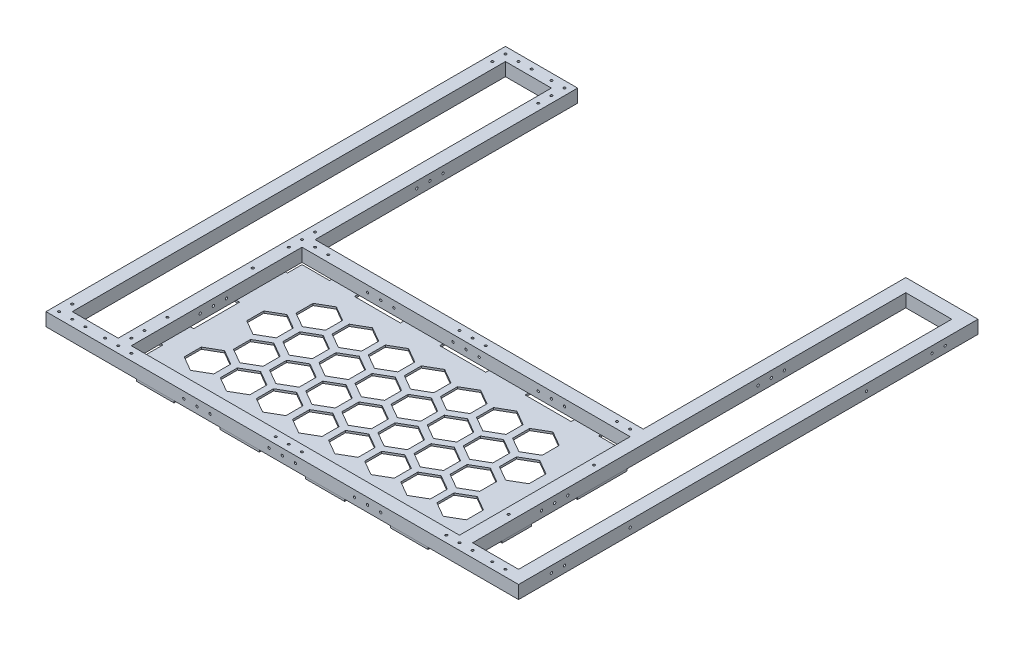
from build123d import *

# Parameters (mm, degrees)
SKETCH_1_W           = 20
SKETCH_1_H           = 660
SKETCH_1_W_2         = 500
SKETCH_1_H_2         = 20
SKETCH_1_W_3         = 720
SKETCH_1_W_4         = 110
EXTRUDE_1_DEPTH      = 20
SKETCH_3_R           = 1.75
CUT_EXTRUDE_1_DEPTH  = 20
CUT_EXTRUDE_2_REACH  = 830.794
SKETCH_4_R           = 1.75
CUT_EXTRUDE_3_REACH  = 753.931
SKETCH_5_R           = 1.75
CUT_EXTRUDE_4_REACH  = 737.255
SKETCH_6_R           = 1.75
SKETCH_7_R           = 1.75
CUT_EXTRUDE_5_DEPTH  = 20
SKETCH_8_R           = 1.75
CUT_EXTRUDE_6_DEPTH  = 20
SKETCH_9_R           = 1.75
CUT_EXTRUDE_7_DEPTH  = 20
SKETCH_10_R          = 1.75
CUT_EXTRUDE_8_DEPTH  = 20
SKETCH_11_R          = 1.75
CUT_EXTRUDE_9_DEPTH  = 20
EXTRUDE_7_DEPTH      = 3
SKETCH_17_R          = 2
CUT_EXTRUDE_10_DEPTH = 3
CUT_EXTRUDE_11_DEPTH = 3


with BuildPart() as part:
    # 草图1 → 凸台-拉伸1 (new body)
    with BuildSketch(Plane(origin=(0, 0, 0), x_dir=(1, 0, 0), z_dir=(0, 1, 0))):
        Polygon((-250, -10), (-250, 10), (-250, 390), (-270, 390), (-270, -270), (-250, -270), align=None)
        Polygon((-270, 390), (-250, 390), (-250, 410), (-360, 410), (-360, 390), (-340, 390), align=None)
        with Locations((-350, 60)):
            Rectangle(SKETCH_1_W, SKETCH_1_H)
        Rectangle(SKETCH_1_W_2, SKETCH_1_H_2)
        with Locations((0, -280)):
            Rectangle(SKETCH_1_W_3, SKETCH_1_H_2)
        Polygon((250, 390), (250, 10), (250, -10), (250, -270), (270, -270), (270, 390), align=None)
        with Locations((350, 60)):
            Rectangle(SKETCH_1_W, SKETCH_1_H)
        with Locations((305, 400)):
            Rectangle(SKETCH_1_W_4, SKETCH_1_H_2)
    extrude(amount=EXTRUDE_1_DEPTH)

    # 草图3 → 切除-拉伸1 (cut)
    with BuildSketch(Plane.XZ):
        with Locations(Location((-330, 280, 0), (0, 0, 270))):
            Circle(SKETCH_3_R)
        with Locations(Location((-310, 280, 0), (0, 0, 270))):
            Circle(SKETCH_3_R)
        with Locations(Location((-350, 260, 0), (0, 0, 270))):
            Circle(SKETCH_3_R)
        with Locations(Location((-350, -380, 0), (0, 0, 270))):
            Circle(SKETCH_3_R)
        with Locations(Location((-330, -400, 0), (0, 0, 270))):
            Circle(SKETCH_3_R)
        with Locations(Location((-310, -400, 0), (0, 0, 270))):
            Circle(SKETCH_3_R)
        with Locations(Location((-280, -400, 0), (0, 0, 270))):
            Circle(SKETCH_3_R)
        with Locations(Location((-260, -360, 0), (0, 0, 270))):
            Circle(SKETCH_3_R)
        with Locations(Location((-260, 280, 0), (0, 0, 270))):
            Circle(SKETCH_3_R)
        with Locations(Location((-240, 280, 0), (0, 0, 270))):
            Circle(SKETCH_3_R)
        with Locations(Location((-280, 280, 0), (0, 0, 270))):
            Circle(SKETCH_3_R)
        with Locations(Location((-260, 260, 0), (0, 0, 270))):
            Circle(SKETCH_3_R)
        with Locations(Location((-260, 240, 0), (0, 0, 270))):
            Circle(SKETCH_3_R)
        with Locations(Location((-260, 20, 0), (0, 0, 270))):
            Circle(SKETCH_3_R)
        with Locations(Location((-260, 0, 0), (0, 0, 270))):
            Circle(SKETCH_3_R)
        with Locations(Location((-260, -20, 0), (0, 0, 270))):
            Circle(SKETCH_3_R)
        with Locations(Location((-240, 0, 0), (0, 0, 270))):
            Circle(SKETCH_3_R)
        with Locations(Location((-220, 0, 0), (0, 0, 270))):
            Circle(SKETCH_3_R)
        with Locations(Location((240, 0, 0), (0, 0, 270))):
            Circle(SKETCH_3_R)
        with Locations(Location((220, 0, 0), (0, 0, 270))):
            Circle(SKETCH_3_R)
        with Locations(Location((240, 280, 0), (0, 0, 270))):
            Circle(SKETCH_3_R)
        with Locations(Location((280, 280, 0), (0, 0, 270))):
            Circle(SKETCH_3_R)
        with Locations(Location((330, 280, 0), (0, 0, 270))):
            Circle(SKETCH_3_R)
        with Locations(Location((310, 280, 0), (0, 0, 270))):
            Circle(SKETCH_3_R)
        with Locations(Location((-350, 280, 0), (0, 0, 270))):
            Circle(SKETCH_3_R)
        with Locations(Location((-350, -400, 0), (0, 0, 270))):
            Circle(SKETCH_3_R)
        with Locations(Location((-260, -400, 0), (0, 0, 270))):
            Circle(SKETCH_3_R)
        with Locations(Location((-260, -380, 0), (0, 0, 270))):
            Circle(SKETCH_3_R)
        with Locations(Location((260, 280, 0), (0, 0, 90))):
            Circle(SKETCH_3_R)
    extrude(amount=-CUT_EXTRUDE_1_DEPTH, mode=Mode.SUBTRACT)

    # 草图4 → 切除-拉伸2 (cut, up to next)
    with BuildSketch(Plane(origin=(360, 0, 0), x_dir=(0, 0, -1), z_dir=(1, 0, 0)), mode=Mode.PRIVATE) as cut_extrude_2_sk1:
        with Locations((-240, 10)):
            Circle(SKETCH_4_R)
    cut_extrude_2_tool1 = extrude(cut_extrude_2_sk1.sketch, amount=-CUT_EXTRUDE_2_REACH, mode=Mode.PRIVATE) & part.part
    # 草图4 → 切除-拉伸2 (cut, up to next)
    with BuildSketch(Plane(origin=(360, 0, 0), x_dir=(0, 0, -1), z_dir=(1, 0, 0)), mode=Mode.PRIVATE) as cut_extrude_2_sk2:
        with Locations((-220, 10)):
            Circle(SKETCH_4_R)
    cut_extrude_2_tool2 = extrude(cut_extrude_2_sk2.sketch, amount=-CUT_EXTRUDE_2_REACH, mode=Mode.PRIVATE) & part.part
    # 草图4 → 切除-拉伸2 (cut, up to next)
    with BuildSketch(Plane(origin=(360, 0, 0), x_dir=(0, 0, -1), z_dir=(1, 0, 0)), mode=Mode.PRIVATE) as cut_extrude_2_sk3:
        with Locations((-120, 10)):
            Circle(SKETCH_4_R)
    cut_extrude_2_tool3 = extrude(cut_extrude_2_sk3.sketch, amount=-CUT_EXTRUDE_2_REACH, mode=Mode.PRIVATE) & part.part
    # 草图4 → 切除-拉伸2 (cut, up to next)
    with BuildSketch(Plane(origin=(360, 0, 0), x_dir=(0, 0, -1), z_dir=(1, 0, 0)), mode=Mode.PRIVATE) as cut_extrude_2_sk4:
        with Locations((360, 10)):
            Circle(SKETCH_4_R)
    cut_extrude_2_tool4 = extrude(cut_extrude_2_sk4.sketch, amount=-CUT_EXTRUDE_2_REACH, mode=Mode.PRIVATE) & part.part
    # 草图4 → 切除-拉伸2 (cut, up to next)
    with BuildSketch(Plane(origin=(360, 0, 0), x_dir=(0, 0, -1), z_dir=(1, 0, 0)), mode=Mode.PRIVATE) as cut_extrude_2_sk5:
        with Locations((340, 10)):
            Circle(SKETCH_4_R)
    cut_extrude_2_tool5 = extrude(cut_extrude_2_sk5.sketch, amount=-CUT_EXTRUDE_2_REACH, mode=Mode.PRIVATE) & part.part
    # 草图4 → 切除-拉伸2 (cut, up to next)
    with BuildSketch(Plane(origin=(360, 0, 0), x_dir=(0, 0, -1), z_dir=(1, 0, 0)), mode=Mode.PRIVATE) as cut_extrude_2_sk6:
        with Locations((240, 10)):
            Circle(SKETCH_4_R)
    cut_extrude_2_tool6 = extrude(cut_extrude_2_sk6.sketch, amount=-CUT_EXTRUDE_2_REACH, mode=Mode.PRIVATE) & part.part
    add(cut_extrude_2_tool1.solids().sort_by_distance((360, 10, 240))[0], mode=Mode.SUBTRACT)
    add(cut_extrude_2_tool2.solids().sort_by_distance((360, 10, 220))[0], mode=Mode.SUBTRACT)
    add(cut_extrude_2_tool3.solids().sort_by_distance((360, 10, 120))[0], mode=Mode.SUBTRACT)
    add(cut_extrude_2_tool4.solids().sort_by_distance((360, 10, -360))[0], mode=Mode.SUBTRACT)
    add(cut_extrude_2_tool5.solids().sort_by_distance((360, 10, -340))[0], mode=Mode.SUBTRACT)
    add(cut_extrude_2_tool6.solids().sort_by_distance((360, 10, -240))[0], mode=Mode.SUBTRACT)

    # 草图5 → 切除-拉伸3 (cut, up to next)
    with BuildSketch(Plane(origin=(270, 0, 0), x_dir=(0, 0, -1), z_dir=(1, 0, 0)), mode=Mode.PRIVATE) as cut_extrude_3_sk1:
        with Locations((165, 10)):
            Circle(SKETCH_5_R)
    cut_extrude_3_tool1 = extrude(cut_extrude_3_sk1.sketch, amount=-CUT_EXTRUDE_3_REACH, mode=Mode.PRIVATE) & part.part
    # 草图5 → 切除-拉伸3 (cut, up to next)
    with BuildSketch(Plane(origin=(270, 0, 0), x_dir=(0, 0, -1), z_dir=(1, 0, 0)), mode=Mode.PRIVATE) as cut_extrude_3_sk2:
        with Locations((185, 10)):
            Circle(SKETCH_5_R)
    cut_extrude_3_tool2 = extrude(cut_extrude_3_sk2.sketch, amount=-CUT_EXTRUDE_3_REACH, mode=Mode.PRIVATE) & part.part
    # 草图5 → 切除-拉伸3 (cut, up to next)
    with BuildSketch(Plane(origin=(270, 0, 0), x_dir=(0, 0, -1), z_dir=(1, 0, 0)), mode=Mode.PRIVATE) as cut_extrude_3_sk3:
        with Locations((205, 10)):
            Circle(SKETCH_5_R)
    cut_extrude_3_tool3 = extrude(cut_extrude_3_sk3.sketch, amount=-CUT_EXTRUDE_3_REACH, mode=Mode.PRIVATE) & part.part
    # 草图5 → 切除-拉伸3 (cut, up to next)
    with BuildSketch(Plane(origin=(270, 0, 0), x_dir=(0, 0, -1), z_dir=(1, 0, 0)), mode=Mode.PRIVATE) as cut_extrude_3_sk4:
        with Locations((-125, 10)):
            Circle(SKETCH_5_R)
    cut_extrude_3_tool4 = extrude(cut_extrude_3_sk4.sketch, amount=-CUT_EXTRUDE_3_REACH, mode=Mode.PRIVATE) & part.part
    # 草图5 → 切除-拉伸3 (cut, up to next)
    with BuildSketch(Plane(origin=(270, 0, 0), x_dir=(0, 0, -1), z_dir=(1, 0, 0)), mode=Mode.PRIVATE) as cut_extrude_3_sk5:
        with Locations((-145, 10)):
            Circle(SKETCH_5_R)
    cut_extrude_3_tool5 = extrude(cut_extrude_3_sk5.sketch, amount=-CUT_EXTRUDE_3_REACH, mode=Mode.PRIVATE) & part.part
    # 草图5 → 切除-拉伸3 (cut, up to next)
    with BuildSketch(Plane(origin=(270, 0, 0), x_dir=(0, 0, -1), z_dir=(1, 0, 0)), mode=Mode.PRIVATE) as cut_extrude_3_sk6:
        with Locations((-165, 10)):
            Circle(SKETCH_5_R)
    cut_extrude_3_tool6 = extrude(cut_extrude_3_sk6.sketch, amount=-CUT_EXTRUDE_3_REACH, mode=Mode.PRIVATE) & part.part
    add(cut_extrude_3_tool1.solids().sort_by_distance((270, 10, -165))[0], mode=Mode.SUBTRACT)
    add(cut_extrude_3_tool2.solids().sort_by_distance((270, 10, -185))[0], mode=Mode.SUBTRACT)
    add(cut_extrude_3_tool3.solids().sort_by_distance((270, 10, -205))[0], mode=Mode.SUBTRACT)
    add(cut_extrude_3_tool4.solids().sort_by_distance((270, 10, 125))[0], mode=Mode.SUBTRACT)
    add(cut_extrude_3_tool5.solids().sort_by_distance((270, 10, 145))[0], mode=Mode.SUBTRACT)
    add(cut_extrude_3_tool6.solids().sort_by_distance((270, 10, 165))[0], mode=Mode.SUBTRACT)

    # 草图6 → 切除-拉伸4 (cut, up to next)
    with BuildSketch(Plane(origin=(-250, 0, 0), x_dir=(0, 0, -1), z_dir=(1, 0, 0)), mode=Mode.PRIVATE) as cut_extrude_4_sk1:
        with Locations((205, 10)):
            Circle(SKETCH_6_R)
    cut_extrude_4_tool1 = extrude(cut_extrude_4_sk1.sketch, amount=-CUT_EXTRUDE_4_REACH, mode=Mode.PRIVATE) & part.part
    # 草图6 → 切除-拉伸4 (cut, up to next)
    with BuildSketch(Plane(origin=(-250, 0, 0), x_dir=(0, 0, -1), z_dir=(1, 0, 0)), mode=Mode.PRIVATE) as cut_extrude_4_sk2:
        with Locations((185, 10)):
            Circle(SKETCH_6_R)
    cut_extrude_4_tool2 = extrude(cut_extrude_4_sk2.sketch, amount=-CUT_EXTRUDE_4_REACH, mode=Mode.PRIVATE) & part.part
    # 草图6 → 切除-拉伸4 (cut, up to next)
    with BuildSketch(Plane(origin=(-250, 0, 0), x_dir=(0, 0, -1), z_dir=(1, 0, 0)), mode=Mode.PRIVATE) as cut_extrude_4_sk3:
        with Locations((165, 10)):
            Circle(SKETCH_6_R)
    cut_extrude_4_tool3 = extrude(cut_extrude_4_sk3.sketch, amount=-CUT_EXTRUDE_4_REACH, mode=Mode.PRIVATE) & part.part
    # 草图6 → 切除-拉伸4 (cut, up to next)
    with BuildSketch(Plane(origin=(-250, 0, 0), x_dir=(0, 0, -1), z_dir=(1, 0, 0)), mode=Mode.PRIVATE) as cut_extrude_4_sk4:
        with Locations((-165, 10)):
            Circle(SKETCH_6_R)
    cut_extrude_4_tool4 = extrude(cut_extrude_4_sk4.sketch, amount=-CUT_EXTRUDE_4_REACH, mode=Mode.PRIVATE) & part.part
    # 草图6 → 切除-拉伸4 (cut, up to next)
    with BuildSketch(Plane(origin=(-250, 0, 0), x_dir=(0, 0, -1), z_dir=(1, 0, 0)), mode=Mode.PRIVATE) as cut_extrude_4_sk5:
        with Locations((-145, 10)):
            Circle(SKETCH_6_R)
    cut_extrude_4_tool5 = extrude(cut_extrude_4_sk5.sketch, amount=-CUT_EXTRUDE_4_REACH, mode=Mode.PRIVATE) & part.part
    # 草图6 → 切除-拉伸4 (cut, up to next)
    with BuildSketch(Plane(origin=(-250, 0, 0), x_dir=(0, 0, -1), z_dir=(1, 0, 0)), mode=Mode.PRIVATE) as cut_extrude_4_sk6:
        with Locations((-125, 10)):
            Circle(SKETCH_6_R)
    cut_extrude_4_tool6 = extrude(cut_extrude_4_sk6.sketch, amount=-CUT_EXTRUDE_4_REACH, mode=Mode.PRIVATE) & part.part
    add(cut_extrude_4_tool1.solids().sort_by_distance((-250, 10, -205))[0], mode=Mode.SUBTRACT)
    add(cut_extrude_4_tool2.solids().sort_by_distance((-250, 10, -185))[0], mode=Mode.SUBTRACT)
    add(cut_extrude_4_tool3.solids().sort_by_distance((-250, 10, -165))[0], mode=Mode.SUBTRACT)
    add(cut_extrude_4_tool4.solids().sort_by_distance((-250, 10, 165))[0], mode=Mode.SUBTRACT)
    add(cut_extrude_4_tool5.solids().sort_by_distance((-250, 10, 145))[0], mode=Mode.SUBTRACT)
    add(cut_extrude_4_tool6.solids().sort_by_distance((-250, 10, 125))[0], mode=Mode.SUBTRACT)

    # 草图7 → 切除-拉伸5 (cut)
    with BuildSketch(Plane.XY.offset(10)):
        with Locations((0, 10)):
            Circle(SKETCH_7_R)
        with Locations((20, 10)):
            Circle(SKETCH_7_R)
        with Locations((-20, 10)):
            Circle(SKETCH_7_R)
        with Locations((110, 10)):
            Circle(SKETCH_7_R)
        with Locations((130, 10)):
            Circle(SKETCH_7_R)
        with Locations((150, 10)):
            Circle(SKETCH_7_R)
        with Locations((-110, 10)):
            Circle(SKETCH_7_R)
        with Locations((-130, 10)):
            Circle(SKETCH_7_R)
        with Locations((-150, 10)):
            Circle(SKETCH_7_R)
    extrude(amount=-CUT_EXTRUDE_5_DEPTH, mode=Mode.SUBTRACT)

    # 草图8 → 切除-拉伸6 (cut)
    with BuildSketch(Plane.XY.offset(290)):
        with Locations((-130, 10)):
            Circle(SKETCH_8_R)
        with Locations((-110, 10)):
            Circle(SKETCH_8_R)
        with Locations((150, 10)):
            Circle(SKETCH_8_R)
        with Locations((130, 10)):
            Circle(SKETCH_8_R)
        with Locations((110, 10)):
            Circle(SKETCH_8_R)
        with Locations((-20, 10)):
            Circle(SKETCH_8_R)
        with Locations((20, 10)):
            Circle(SKETCH_8_R)
        with Locations((0, 10)):
            Circle(SKETCH_8_R)
        with Locations((-150, 10)):
            Circle(SKETCH_8_R)
    extrude(amount=-CUT_EXTRUDE_6_DEPTH, mode=Mode.SUBTRACT)

    # 草图9 → 切除-拉伸7 (cut)
    with BuildSketch(Plane(origin=(0, 20, 0), x_dir=(1, 0, 0), z_dir=(0, 1, 0))):
        with Locations(Location((0, 0, 0), (0, 0, 270))):
            Circle(SKETCH_9_R)
        with Locations(Location((20, 0, 0), (0, 0, 270))):
            Circle(SKETCH_9_R)
        with Locations(Location((-20, 0, 0), (0, 0, 270))):
            Circle(SKETCH_9_R)
    extrude(amount=-CUT_EXTRUDE_7_DEPTH, mode=Mode.SUBTRACT)

    # 草图10 → 切除-拉伸8 (cut)
    with BuildSketch(Plane(origin=(0, 20, 0), x_dir=(1, 0, 0), z_dir=(0, 1, 0))):
        with Locations(Location((0, -280, 0), (0, 0, 270))):
            Circle(SKETCH_10_R)
        with Locations(Location((20, -280, 0), (0, 0, 270))):
            Circle(SKETCH_10_R)
        with Locations(Location((-20, -280, 0), (0, 0, 270))):
            Circle(SKETCH_10_R)
    extrude(amount=-CUT_EXTRUDE_8_DEPTH, mode=Mode.SUBTRACT)

    # 草图11 → 切除-拉伸9 (cut)
    with BuildSketch(Plane(origin=(0, 20, 0), x_dir=(1, 0, 0), z_dir=(0, 1, 0))):
        with Locations(Location((-260, -75, 0), (0, 0, 270))):
            Circle(SKETCH_11_R)
        with Locations(Location((-260, -205, 0), (0, 0, 270))):
            Circle(SKETCH_11_R)
        with Locations(Location((260, -205, 0), (0, 0, 90))):
            Circle(SKETCH_11_R)
        with Locations(Location((260, -75, 0), (0, 0, 90))):
            Circle(SKETCH_11_R)
    extrude(amount=-CUT_EXTRUDE_9_DEPTH, mode=Mode.SUBTRACT)


with BuildPart() as body_2:
    # 草图16 → 凸台-拉伸7 (new body)
    with BuildSketch(Plane.XZ):
        Polygon((-270, 225), (-247, 225), (-247, 267), (-222, 267), (-222, 290), (-165, 290), (-165, 265), (-95, 265), (-95, 290), (-35, 290), (-35, 265), (35, 265), (35, 290), (95, 290), (95, 265), (165, 265), (165, 290), (222, 290), (222, 267), (247, 267), (247, 225), (270, 225), (270, 180), (245, 180), (245, 110), (270, 110), (270, 35), (247, 35), (247, 13), (205, 13), (205, -10), (165, -10), (165, 15), (95, 15), (95, -10), (35, -10), (35, 15), (-35, 15), (-35, -10), (-95, -10), (-95, 15), (-165, 15), (-165, -10), (-205, -10), (-205, 13), (-247, 13), (-247, 35), (-270, 35), (-270, 110), (-245, 110), (-245, 180), (-270, 180), align=None)
    extrude(amount=EXTRUDE_7_DEPTH)

    # 草图17 → 切除-拉伸10 (cut)
    with BuildSketch(Plane.XZ.offset(3)):
        with Locations(Location((-260, 205, 0), (0, 0, 270))):
            Circle(SKETCH_17_R)
        with Locations(Location((-260, 75, 0), (0, 0, 270))):
            Circle(SKETCH_17_R)
        with Locations(Location((260, 205, 0), (0, 0, 270))):
            Circle(SKETCH_17_R)
        with Locations(Location((260, 75, 0), (0, 0, 270))):
            Circle(SKETCH_17_R)
    extrude(amount=-CUT_EXTRUDE_10_DEPTH, mode=Mode.SUBTRACT)

    # 草图19 → 切除-拉伸11 (cut)
    with BuildSketch(Plane.XZ.offset(3)):
        Polygon((-215, 224.437476869), (-215, 198.456714755), (-192.5, 185.466333699), (-170, 198.456714755), (-170, 224.437476869), (-192.5, 237.427857926), align=None)
        Polygon((-160, 224.437476869), (-160, 198.456714755), (-137.5, 185.466333699), (-115, 198.456714755), (-115, 224.437476869), (-137.5, 237.427857926), align=None)
        Polygon((-105, 224.437476869), (-105, 198.456714755), (-82.5, 185.466333699), (-60, 198.456714755), (-60, 224.437476869), (-82.5, 237.427857926), align=None)
        Polygon((-50, 224.437476869), (-50, 198.456714755), (-27.5, 185.466333699), (-5, 198.456714755), (-5, 224.437476869), (-27.5, 237.427857926), align=None)
        Polygon((5, 224.437476869), (5, 198.456714755), (27.5, 185.466333699), (50, 198.456714755), (50, 224.437476869), (27.5, 237.427857926), align=None)
        Polygon((60, 224.437476869), (60, 198.456714755), (82.5, 185.466333699), (105, 198.456714755), (105, 224.437476869), (82.5, 237.427857926), align=None)
        Polygon((115, 224.437476869), (115, 198.456714755), (137.5, 185.466333699), (160, 198.456714755), (160, 224.437476869), (137.5, 237.427857926), align=None)
        Polygon((170, 224.437476869), (170, 198.456714755), (192.5, 185.466333699), (215, 198.456714755), (215, 224.437476869), (192.5, 237.427857926), align=None)
        Polygon((142.5, 176.806079661), (142.5, 150.825317547), (165, 137.834936491), (187.5, 150.825317547), (187.5, 176.806079661), (165, 189.796460718), align=None)
        Polygon((87.5, 176.806079661), (87.5, 150.825317547), (110, 137.834936491), (132.5, 150.825317547), (132.5, 176.806079661), (110, 189.796460718), align=None)
        Polygon((32.5, 176.806079661), (32.5, 150.825317547), (55, 137.834936491), (77.5, 150.825317547), (77.5, 176.806079661), (55, 189.796460718), align=None)
        Polygon((-22.5, 176.806079661), (-22.5, 150.825317547), (0, 137.834936491), (22.5, 150.825317547), (22.5, 176.806079661), (0, 189.796460718), align=None)
        Polygon((-77.5, 176.806079661), (-77.5, 150.825317547), (-55, 137.834936491), (-32.5, 150.825317547), (-32.5, 176.806079661), (-55, 189.796460718), align=None)
        Polygon((-132.5, 176.806079661), (-132.5, 150.825317547), (-110, 137.834936491), (-87.5, 150.825317547), (-87.5, 176.806079661), (-110, 189.796460718), align=None)
        Polygon((-187.5, 176.806079661), (-187.5, 150.825317547), (-165, 137.834936491), (-142.5, 150.825317547), (-142.5, 176.806079661), (-165, 189.796460718), align=None)
        Polygon((-215, 129.174682453), (-215, 103.193920339), (-192.5, 90.203539282), (-170, 103.193920339), (-170, 129.174682453), (-192.5, 142.165063509), align=None)
        Polygon((-160, 129.174682453), (-160, 103.193920339), (-137.5, 90.203539282), (-115, 103.193920339), (-115, 129.174682453), (-137.5, 142.165063509), align=None)
        Polygon((-105, 129.174682453), (-105, 103.193920339), (-82.5, 90.203539282), (-60, 103.193920339), (-60, 129.174682453), (-82.5, 142.165063509), align=None)
        Polygon((-50, 129.174682453), (-50, 103.193920339), (-27.5, 90.203539282), (-5, 103.193920339), (-5, 129.174682453), (-27.5, 142.165063509), align=None)
        Polygon((5, 129.174682453), (5, 103.193920339), (27.5, 90.203539282), (50, 103.193920339), (50, 129.174682453), (27.5, 142.165063509), align=None)
        Polygon((60, 129.174682453), (60, 103.193920339), (82.5, 90.203539282), (105, 103.193920339), (105, 129.174682453), (82.5, 142.165063509), align=None)
        Polygon((115, 129.174682453), (115, 103.193920339), (137.5, 90.203539282), (160, 103.193920339), (160, 129.174682453), (137.5, 142.165063509), align=None)
        Polygon((170, 129.174682453), (170, 103.193920339), (192.5, 90.203539282), (215, 103.193920339), (215, 129.174682453), (192.5, 142.165063509), align=None)
        Polygon((142.5, 81.543285245), (142.5, 55.562523131), (165, 42.572142074), (187.5, 55.562523131), (187.5, 81.543285245), (165, 94.533666301), align=None)
        Polygon((87.5, 81.543285245), (87.5, 55.562523131), (110, 42.572142074), (132.5, 55.562523131), (132.5, 81.543285245), (110, 94.533666301), align=None)
        Polygon((32.5, 81.543285245), (32.5, 55.562523131), (55, 42.572142074), (77.5, 55.562523131), (77.5, 81.543285245), (55, 94.533666301), align=None)
        Polygon((-22.5, 81.543285245), (-22.5, 55.562523131), (0, 42.572142074), (22.5, 55.562523131), (22.5, 81.543285245), (0, 94.533666301), align=None)
        Polygon((-77.5, 81.543285245), (-77.5, 55.562523131), (-55, 42.572142074), (-32.5, 55.562523131), (-32.5, 81.543285245), (-55, 94.533666301), align=None)
        Polygon((-132.5, 81.543285245), (-132.5, 55.562523131), (-110, 42.572142074), (-87.5, 55.562523131), (-87.5, 81.543285245), (-110, 94.533666301), align=None)
        Polygon((-187.5, 81.543285245), (-187.5, 55.562523131), (-165, 42.572142074), (-142.5, 55.562523131), (-142.5, 81.543285245), (-165, 94.533666301), align=None)
    extrude(amount=-CUT_EXTRUDE_11_DEPTH, mode=Mode.SUBTRACT)


solid = Compound([part.part, body_2.part])
